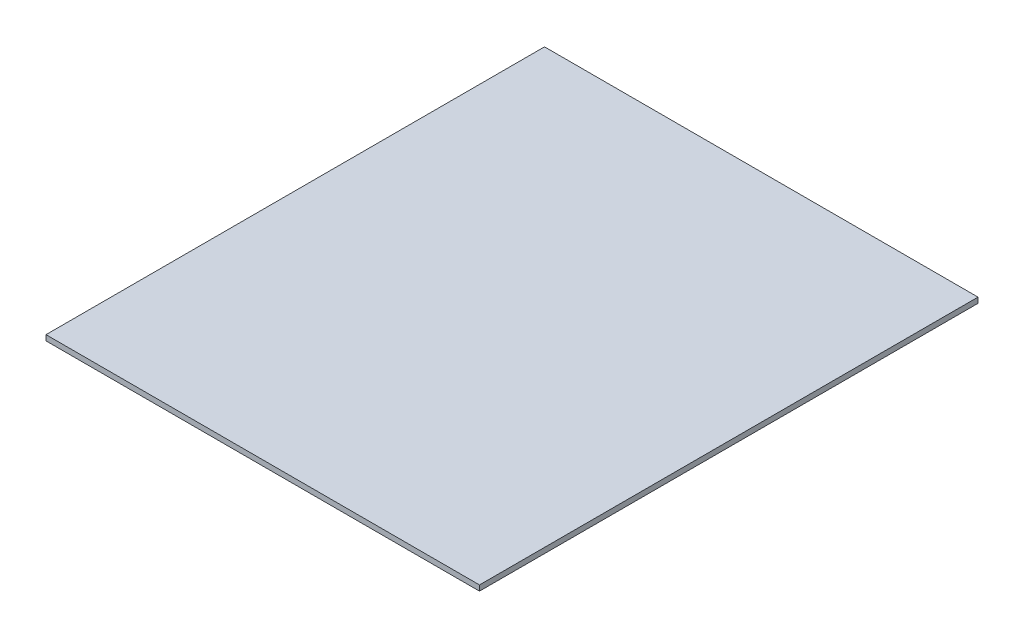
from build123d import *

# Parameters (mm, degrees)
SKETCH1_W           = 254
SKETCH1_H           = 292.1
BOSS_EXTRUDE1_DEPTH = 3.175


with BuildPart() as part:
    # Sketch1 → Boss-Extrude1 (new body)
    with BuildSketch(Plane(origin=(0, 0, 0), x_dir=(1, 0, 0), z_dir=(0, 1, 0))):
        with Locations((127, 146.05)):
            Rectangle(SKETCH1_W, SKETCH1_H)
    extrude(amount=BOSS_EXTRUDE1_DEPTH)


solid = part.part
